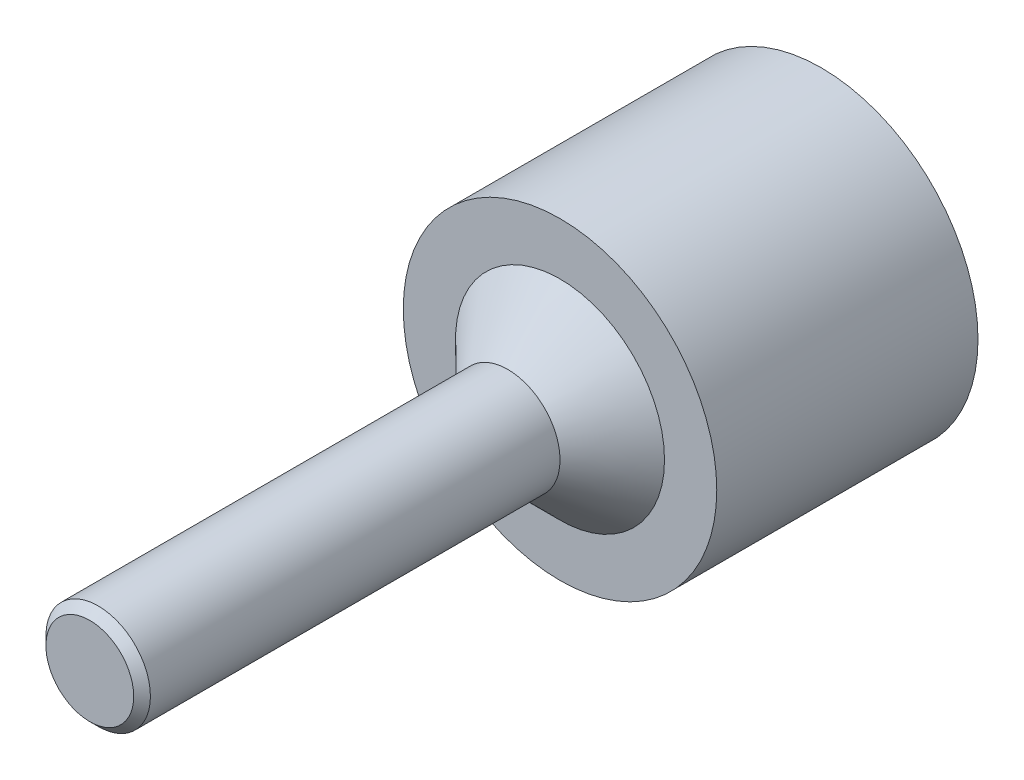
from build123d import *

# Parameters (mm, degrees)
SKETCH4_R                  = 6.35
SHAFT_BORE_DEPTH           = 12.7
F_4_40_TAPPED_HOLE1_REACH  = 51.289
F_4_40_TAPPED_HOLE1_BORE_R = 1.1303
CHAMFER1_SIZE              = 0.508
CHAMFER2_SIZE              = 3.175
CHAMFER3_SIZE              = 0.508


with BuildPart() as part:
    # Sketch → Shaft (revolve)
    with BuildSketch(Plane(origin=(0, 0, 0), x_dir=(0, 0, -1), z_dir=(1, 0, 0)), mode=Mode.PRIVATE) as shaft_sk:
        Polygon((0, 0), (0, 3.175), (28.575, 3.175), (28.575, 9.525), (44.45, 9.525), (44.45, 0), align=None)
    revolve(shaft_sk.sketch.rotate(Axis((0, 0, -44.45), (0, 0, 1)), 90), axis=Axis((0, 0, -44.45), (0, 0, 1)))

    # Sketch4 → Shaft Bore (cut)
    with BuildSketch(Plane(origin=(0, 0, -44.45), x_dir=(-1, 0, 0), z_dir=(0, 0, -1))):
        Circle(SKETCH4_R)
    extrude(amount=-SHAFT_BORE_DEPTH, mode=Mode.SUBTRACT)

    # #4-40 Tapped Hole1 bore → #4-40 Tapped Hole1 (cut, up to next)
    with BuildSketch(Plane(origin=(0, -9.525, 0), x_dir=(-1, 0, 0), z_dir=(0, -1, 0)), mode=Mode.PRIVATE) as f_4_40_tapped_hole1_sk1:
        with Locations((0, 34.925)):
            Circle(F_4_40_TAPPED_HOLE1_BORE_R)
    f_4_40_tapped_hole1_tool1 = extrude(f_4_40_tapped_hole1_sk1.sketch, amount=-F_4_40_TAPPED_HOLE1_REACH, mode=Mode.PRIVATE) & part.part
    # #4-40 Tapped Hole1 bore → #4-40 Tapped Hole1 (cut, up to next)
    with BuildSketch(Plane(origin=(0, -9.525, 0), x_dir=(-1, 0, 0), z_dir=(0, -1, 0)), mode=Mode.PRIVATE) as f_4_40_tapped_hole1_sk2:
        with Locations((0, 41.275)):
            Circle(F_4_40_TAPPED_HOLE1_BORE_R)
    f_4_40_tapped_hole1_tool2 = extrude(f_4_40_tapped_hole1_sk2.sketch, amount=-F_4_40_TAPPED_HOLE1_REACH, mode=Mode.PRIVATE) & part.part
    add(f_4_40_tapped_hole1_tool1.solids().sort_by_distance((0, -9.525, -34.925))[0], mode=Mode.SUBTRACT)
    add(f_4_40_tapped_hole1_tool2.solids().sort_by_distance((0, -9.525, -41.275))[0], mode=Mode.SUBTRACT)

    # Chamfer1
    chamfer1_edges = [part.edges().sort_by_distance(p)[0] for p in [
        (3.175, 0, 0),
    ]]
    chamfer(chamfer1_edges, length=CHAMFER1_SIZE)

    # Chamfer2
    chamfer2_edges = [part.edges().sort_by_distance(p)[0] for p in [
        (3.175, 0, -28.575),
    ]]
    chamfer(chamfer2_edges, length=CHAMFER2_SIZE)

    # Chamfer3
    chamfer3_edges = [part.edges().sort_by_distance(p)[0] for p in [
        (6.35, 0, -44.45),
    ]]
    chamfer(chamfer3_edges, length=CHAMFER3_SIZE)


solid = part.part
